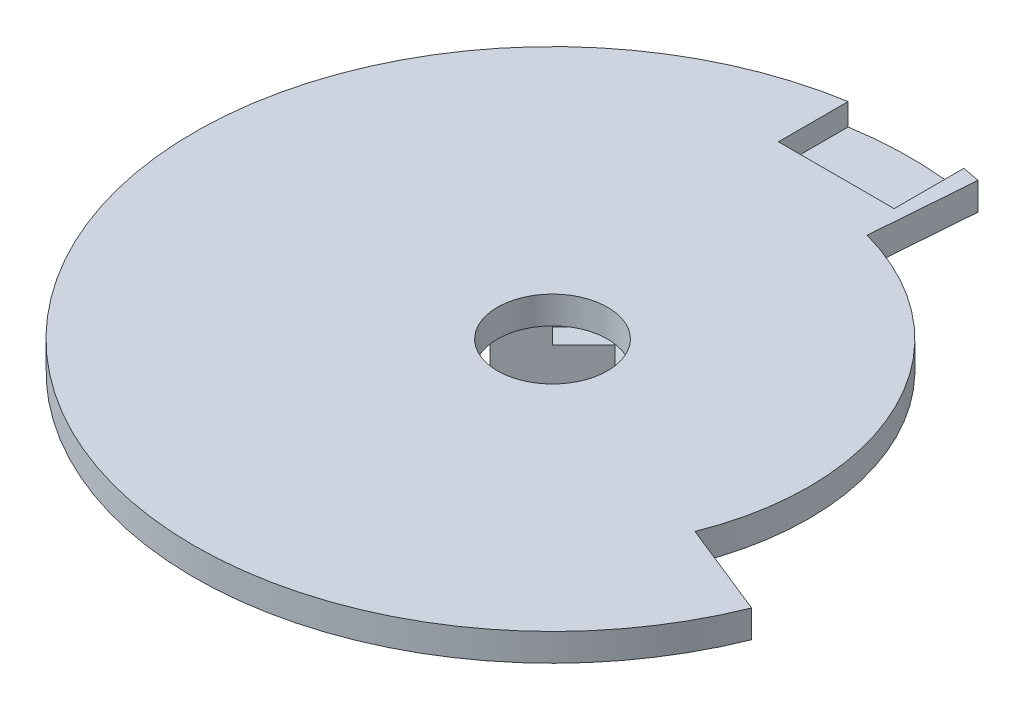
from build123d import *

# Parameters (mm, degrees)
SKETCH1_R           = 65
BOSS_EXTRUDE1_DEPTH = 5
SKETCH2_R           = 10
CUT_EXTRUDE1_DEPTH  = 5
CUT_EXTRUDE3_DEPTH  = 4
CUT_EXTRUDE2_DEPTH  = 93.059763198
BOSS_EXTRUDE2_DEPTH = 11
BOSS_EXTRUDE3_DEPTH = 5
CUT_EXTRUDE4_DEPTH  = 5
CUT_EXTRUDE5_DEPTH  = 2.5
SKETCH16_W          = 21
SKETCH16_H          = 2
BOSS_EXTRUDE5_DEPTH = 4
SKETCH17_W          = 4
SKETCH17_H          = 4
CUT_EXTRUDE8_DEPTH  = 8
BOSS_EXTRUDE6_DEPTH = 6.5
SKETCH23_W          = 64
SKETCH23_H          = 3.5
CUT_EXTRUDE9_DEPTH  = 10


with BuildPart() as part:
    # Sketch1 → Boss-Extrude1 (new body)
    with BuildSketch(Plane(origin=(0, 0, 0), x_dir=(1, 0, 0), z_dir=(0, 1, 0))):
        with Locations(Location((0, 0, 0), (0, 0, 270))):
            Circle(SKETCH1_R)
    extrude(amount=BOSS_EXTRUDE1_DEPTH)

    # Sketch2 → Cut-Extrude1 (cut)
    with BuildSketch(Plane(origin=(0, 5, 0), x_dir=(1, 0, 0), z_dir=(0, 1, 0))):
        with Locations(Location((0, 0, 0), (0, 0, 270))):
            Circle(SKETCH2_R)
    extrude(amount=-CUT_EXTRUDE1_DEPTH, mode=Mode.SUBTRACT)

    # Sketch5 → Cut-Extrude3 (cut)
    with BuildSketch(Plane(origin=(0, 5, 0), x_dir=(1, 0, 0), z_dir=(0, 1, 0))):
        Polygon((0, 47.5), (10.5, 47.5), (10.5, 65), (-10.5, 65), (-10.5, 47.5), align=None)
    extrude(amount=-CUT_EXTRUDE3_DEPTH, mode=Mode.SUBTRACT)

    # Sketch3 → Cut-Extrude2 (cut, through all)
    with BuildSketch(Plane(origin=(0, 5, 0), x_dir=(1, 0, 0), z_dir=(0, 1, 0))):
        with BuildLine():
            Line((43.158190089, -17.309553092), (60.328652813, -24.196149483))
            ThreePointArc((60.328652813, -24.196149483), (63.821479272, -12.321476518), (65, 0))
            ThreePointArc((65, 0), (54.706549574, 35.102612918), (27.086355887, 59.087471809))
            ThreePointArc((27.086355887, 59.087471809), (24.677873317, 60.133206871), (22.229121422, 61.080816635))
            ThreePointArc((22.229121422, 61.080816635), (17.992417486, 62.460170613), (13.671171428, 63.546038994))
            Line((13.671171428, 63.546038994), (12.228525973, 44.863271755))
            ThreePointArc((12.228525973, 44.863271755), (14.077546566, 44.317859636), (15.902371478, 43.696276516))
            ThreePointArc((15.902371478, 43.696276516), (17.654170911, 43.018371069), (19.377162288, 42.270268294))
            ThreePointArc((19.377162288, 42.270268294), (39.136223926, 25.111869241), (46.5, 0))
            ThreePointArc((46.5, 0), (45.656904402, -8.81459474), (43.158190089, -17.309553092))
        make_face()
    extrude(amount=-CUT_EXTRUDE2_DEPTH, mode=Mode.SUBTRACT)

    # Sketch9 → Boss-Extrude2 (add)
    with BuildSketch(Plane.XZ):
        Polygon((-13.753226894, -2.439518395), (-16.581654019, -5.26794552), (-5.26794552, -16.581654019), (-2.439518395, -13.753226894), align=None)
        Polygon((9.899494937, 21.213203436), (7.071067812, 18.384776311), (18.384776311, 7.071067812), (21.213203436, 9.899494937), align=None)
    extrude(amount=BOSS_EXTRUDE2_DEPTH)

    # Sketch10 → Boss-Extrude3 (add)
    with BuildSketch(Plane.XZ.offset(11)):
        Polygon((-5.26794552, -16.581654019), (-16.581654019, -5.26794552), (9.899494937, 21.213203436), (21.213203436, 9.899494937), align=None)
    extrude(amount=BOSS_EXTRUDE3_DEPTH)

    # Sketch11 → Cut-Extrude4 (cut)
    with BuildSketch(Plane.XZ.offset(16)):
        Polygon((6.805902769, 15.467960838), (15.467960838, 6.805902769), (-0.618718434, -9.280776503), (-9.280776503, -0.618718434), align=None)
    extrude(amount=-CUT_EXTRUDE4_DEPTH, mode=Mode.SUBTRACT)

    # Sketch12 → Cut-Extrude5 (cut)
    with BuildSketch(Plane.XZ.offset(16)):
        Polygon((-4.154251265, -12.816309334), (-0.618718434, -9.280776503), (-9.280776503, -0.618718434), (-12.816309334, -4.154251265), align=None)
        Polygon((6.805902769, 15.467960838), (10.3414356, 19.00349367), (19.00349367, 10.3414356), (15.467960838, 6.805902769), align=None)
    extrude(amount=-CUT_EXTRUDE5_DEPTH, mode=Mode.SUBTRACT)

    # Sketch16 → Boss-Extrude5 (add)
    with BuildSketch(Plane(origin=(0, 0, -47.5), x_dir=(-1, 0, 0), z_dir=(0, 0, -1))):
        with Locations((0, 4)):
            Rectangle(SKETCH16_W, SKETCH16_H)
    extrude(amount=BOSS_EXTRUDE5_DEPTH)

    # Sketch17 → Cut-Extrude8 (cut)
    with BuildSketch(Plane(origin=(5.656854249, 0, -5.656854249), x_dir=(-0.7071067811865472, 0, -0.7071067811865479), z_dir=(0.7071067811865479, 0, -0.7071067811865472))):
        with Locations((13.45, -2)):
            Rectangle(SKETCH17_W, SKETCH17_H)
    extrude(amount=-CUT_EXTRUDE8_DEPTH, mode=Mode.SUBTRACT)

    # Sketch22 → Boss-Extrude6 (add)
    with BuildSketch(Plane.XZ):
        Polygon((21.213203436, 9.899494937), (35.355339059, 24.04163056), (42.426406871, 16.970562748), (-7.071067812, -32.526911935), (-14.142135624, -25.455844123), align=None)
    extrude(amount=BOSS_EXTRUDE6_DEPTH)

    # Sketch23 → Cut-Extrude9 (cut)
    with BuildSketch(Plane(origin=(12.727922061, 0, -12.727922061), x_dir=(-0.7071067811865476, 0, -0.7071067811865476), z_dir=(0.7071067811865476, 0, -0.7071067811865476))):
        with Locations((-7, -1.75)):
            Rectangle(SKETCH23_W, SKETCH23_H)
    extrude(amount=-CUT_EXTRUDE9_DEPTH, mode=Mode.SUBTRACT)


solid = part.part
